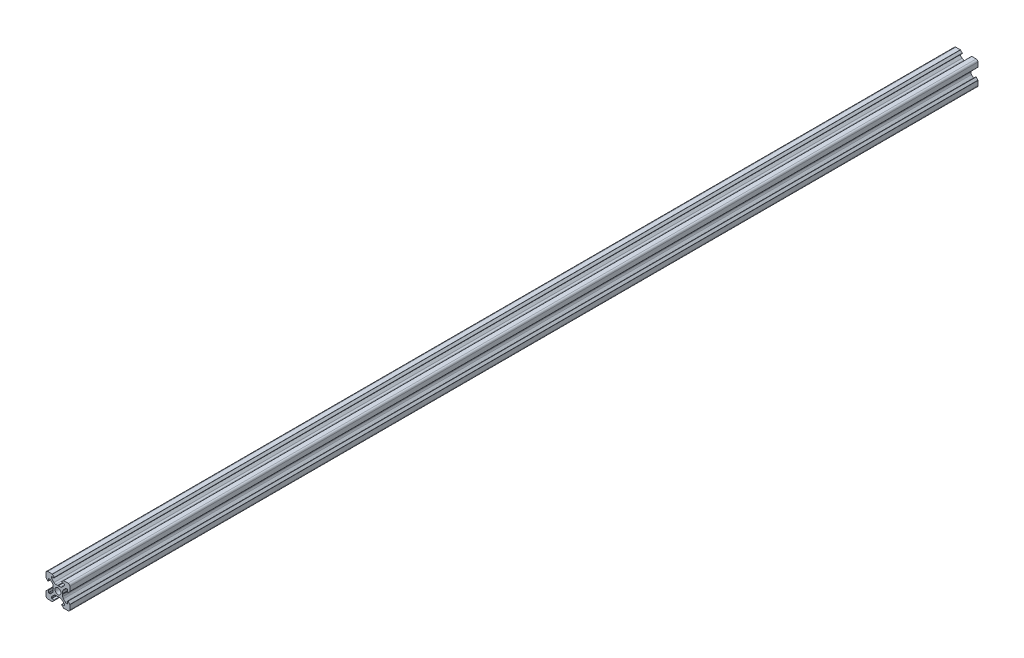
from build123d import *

# Parameters (mm, degrees)
MODEL_R         = 2.5
EXTRUDE_1_DEPTH = 760


with BuildPart() as part:
    # Model → Бобышка-Вытянуть1 (new body)
    with BuildSketch(Plane.XY):
        with BuildLine():
            Line((18.94214915, 33.362214718), (18.94214915, 34.923300122))
            ThreePointArc((18.94214915, 34.923300122), (18.789908215, 35.688666987), (18.356362712, 36.337513684))
            Line((18.356362712, 36.337513684), (16.662250163, 38.031626234))
            ThreePointArc((16.662250163, 38.031626234), (16.337826814, 38.248398985), (15.955143382, 38.324519453))
            Line((15.955143382, 38.324519453), (15.14214915, 38.324519453))
            ThreePointArc((15.14214915, 38.324519453), (15.000727794, 38.265940809), (14.94214915, 38.124519453))
            Line((14.94214915, 38.124519453), (14.94214915, 36.354519453))
            ThreePointArc((14.94214915, 36.354519453), (14.787820008, 36.12354957), (14.515372455, 36.177742757))
            Line((14.515372455, 36.177742757), (13.015372455, 37.677742757))
            ThreePointArc((13.015372455, 37.677742757), (12.961179267, 37.758848595), (12.94214915, 37.854519453))
            Line((12.94214915, 37.854519453), (12.94214915, 41.524519453))
            ThreePointArc((12.94214915, 41.524519453), (13.381488978, 42.585179625), (14.44214915, 43.024519453))
            Line((14.44214915, 43.024519453), (18.11214915, 43.024519453))
            ThreePointArc((18.11214915, 43.024519453), (18.207820008, 43.005489336), (18.288925845, 42.951296148))
            Line((18.288925845, 42.951296148), (19.788925845, 41.451296148))
            ThreePointArc((19.788925845, 41.451296148), (19.843119033, 41.178848595), (19.61214915, 41.024519453))
            Line((19.61214915, 41.024519453), (17.84214915, 41.024519453))
            ThreePointArc((17.84214915, 41.024519453), (17.700727794, 40.965940809), (17.64214915, 40.824519453))
            Line((17.64214915, 40.824519453), (17.64214915, 40.011525221))
            ThreePointArc((17.64214915, 40.011525221), (17.718269617, 39.628841789), (17.935042369, 39.30441844))
            Line((17.935042369, 39.30441844), (19.629154919, 37.61030589))
            ThreePointArc((19.629154919, 37.61030589), (20.278001616, 37.176760388), (21.043368481, 37.024519453))
            Line((21.043368481, 37.024519453), (22.604453885, 37.024519453))
            ThreePointArc((22.604453885, 37.024519453), (22.687205621, 37.010426533), (22.760627647, 36.969736655))
            Line((22.760627647, 36.969736655), (22.94214915, 36.824519453))
            Line((22.94214915, 36.824519453), (23.123670653, 36.969736655))
            ThreePointArc((23.123670653, 36.969736655), (23.197092679, 37.010426533), (23.279844415, 37.024519453))
            Line((23.279844415, 37.024519453), (24.840929819, 37.024519453))
            ThreePointArc((24.840929819, 37.024519453), (25.606296684, 37.176760388), (26.255143382, 37.61030589))
            Line((26.255143382, 37.61030589), (27.949255931, 39.30441844))
            ThreePointArc((27.949255931, 39.30441844), (28.166028683, 39.628841789), (28.24214915, 40.011525221))
            Line((28.24214915, 40.011525221), (28.24214915, 40.824519453))
            ThreePointArc((28.24214915, 40.824519453), (28.183570506, 40.965940809), (28.04214915, 41.024519453))
            Line((28.04214915, 41.024519453), (26.27214915, 41.024519453))
            ThreePointArc((26.27214915, 41.024519453), (26.041179267, 41.178848595), (26.095372455, 41.451296148))
            Line((26.095372455, 41.451296148), (27.595372455, 42.951296148))
            ThreePointArc((27.595372455, 42.951296148), (27.676478292, 43.005489336), (27.77214915, 43.024519453))
            Line((27.77214915, 43.024519453), (31.44214915, 43.024519453))
            ThreePointArc((31.44214915, 43.024519453), (32.502809322, 42.585179625), (32.94214915, 41.524519453))
            Line((32.94214915, 41.524519453), (32.94214915, 37.854519453))
            ThreePointArc((32.94214915, 37.854519453), (32.923119033, 37.758848595), (32.868925845, 37.677742757))
            Line((32.868925845, 37.677742757), (31.368925845, 36.177742757))
            ThreePointArc((31.368925845, 36.177742757), (31.096478292, 36.12354957), (30.94214915, 36.354519453))
            Line((30.94214915, 36.354519453), (30.94214915, 38.124519453))
            ThreePointArc((30.94214915, 38.124519453), (30.883570506, 38.265940809), (30.74214915, 38.324519453))
            Line((30.74214915, 38.324519453), (29.929154919, 38.324519453))
            ThreePointArc((29.929154919, 38.324519453), (29.546471486, 38.248398985), (29.222048137, 38.031626234))
            Line((29.222048137, 38.031626234), (27.527935588, 36.337513684))
            ThreePointArc((27.527935588, 36.337513684), (27.094390085, 35.688666987), (26.94214915, 34.923300122))
            Line((26.94214915, 34.923300122), (26.94214915, 33.362214718))
            ThreePointArc((26.94214915, 33.362214718), (26.92805623, 33.279462982), (26.887366352, 33.206040956))
            Line((26.887366352, 33.206040956), (26.74214915, 33.024519453))
            Line((26.74214915, 33.024519453), (26.887366352, 32.84299795))
            ThreePointArc((26.887366352, 32.84299795), (26.92805623, 32.769575923), (26.94214915, 32.686824188))
            Line((26.94214915, 32.686824188), (26.94214915, 31.125738784))
            ThreePointArc((26.94214915, 31.125738784), (27.094390085, 30.360371919), (27.527935588, 29.711525221))
            Line((27.527935588, 29.711525221), (29.222048137, 28.017412672))
            ThreePointArc((29.222048137, 28.017412672), (29.546471486, 27.80063992), (29.929154919, 27.724519453))
            Line((29.929154919, 27.724519453), (30.74214915, 27.724519453))
            ThreePointArc((30.74214915, 27.724519453), (30.883570506, 27.783098097), (30.94214915, 27.924519453))
            Line((30.94214915, 27.924519453), (30.94214915, 29.694519453))
            ThreePointArc((30.94214915, 29.694519453), (31.096478292, 29.925489336), (31.368925845, 29.871296148))
            Line((31.368925845, 29.871296148), (32.868925845, 28.371296148))
            ThreePointArc((32.868925845, 28.371296148), (32.923119033, 28.290190311), (32.94214915, 28.194519453))
            Line((32.94214915, 28.194519453), (32.94214915, 24.524519453))
            ThreePointArc((32.94214915, 24.524519453), (32.502809322, 23.463859281), (31.44214915, 23.024519453))
            Line((31.44214915, 23.024519453), (27.77214915, 23.024519453))
            ThreePointArc((27.77214915, 23.024519453), (27.676478292, 23.04354957), (27.595372455, 23.097742757))
            Line((27.595372455, 23.097742757), (26.095372455, 24.597742757))
            ThreePointArc((26.095372455, 24.597742757), (26.041179267, 24.870190311), (26.27214915, 25.024519453))
            Line((26.27214915, 25.024519453), (28.04214915, 25.024519453))
            ThreePointArc((28.04214915, 25.024519453), (28.183570506, 25.083098097), (28.24214915, 25.224519453))
            Line((28.24214915, 25.224519453), (28.24214915, 26.037513684))
            ThreePointArc((28.24214915, 26.037513684), (28.166028683, 26.420197117), (27.949255931, 26.744620465))
            Line((27.949255931, 26.744620465), (26.255143382, 28.438733015))
            ThreePointArc((26.255143382, 28.438733015), (25.606296684, 28.872278518), (24.840929819, 29.024519453))
            Line((24.840929819, 29.024519453), (23.279844415, 29.024519453))
            ThreePointArc((23.279844415, 29.024519453), (23.197092679, 29.038612373), (23.123670653, 29.07930225))
            Line((23.123670653, 29.07930225), (22.94214915, 29.224519453))
            Line((22.94214915, 29.224519453), (22.760627647, 29.07930225))
            ThreePointArc((22.760627647, 29.07930225), (22.687205621, 29.038612373), (22.604453885, 29.024519453))
            Line((22.604453885, 29.024519453), (21.043368481, 29.024519453))
            ThreePointArc((21.043368481, 29.024519453), (20.278001616, 28.872278518), (19.629154919, 28.438733015))
            Line((19.629154919, 28.438733015), (17.935042369, 26.744620465))
            ThreePointArc((17.935042369, 26.744620465), (17.718269617, 26.420197117), (17.64214915, 26.037513684))
            Line((17.64214915, 26.037513684), (17.64214915, 25.224519453))
            ThreePointArc((17.64214915, 25.224519453), (17.700727794, 25.083098097), (17.84214915, 25.024519453))
            Line((17.84214915, 25.024519453), (19.61214915, 25.024519453))
            ThreePointArc((19.61214915, 25.024519453), (19.843119033, 24.870190311), (19.788925845, 24.597742757))
            Line((19.788925845, 24.597742757), (18.288925845, 23.097742757))
            ThreePointArc((18.288925845, 23.097742757), (18.207820008, 23.04354957), (18.11214915, 23.024519453))
            Line((18.11214915, 23.024519453), (14.44214915, 23.024519453))
            ThreePointArc((14.44214915, 23.024519453), (13.381488978, 23.463859281), (12.94214915, 24.524519453))
            Line((12.94214915, 24.524519453), (12.94214915, 28.194519453))
            ThreePointArc((12.94214915, 28.194519453), (12.961179267, 28.290190311), (13.015372455, 28.371296148))
            Line((13.015372455, 28.371296148), (14.515372455, 29.871296148))
            ThreePointArc((14.515372455, 29.871296148), (14.787820008, 29.925489336), (14.94214915, 29.694519453))
            Line((14.94214915, 29.694519453), (14.94214915, 27.924519453))
            ThreePointArc((14.94214915, 27.924519453), (15.000727794, 27.783098097), (15.14214915, 27.724519453))
            Line((15.14214915, 27.724519453), (15.955143382, 27.724519453))
            ThreePointArc((15.955143382, 27.724519453), (16.337826814, 27.80063992), (16.662250163, 28.017412672))
            Line((16.662250163, 28.017412672), (18.356362712, 29.711525221))
            ThreePointArc((18.356362712, 29.711525221), (18.789908215, 30.360371919), (18.94214915, 31.125738784))
            Line((18.94214915, 31.125738784), (18.94214915, 32.686824188))
            ThreePointArc((18.94214915, 32.686824188), (18.95624207, 32.769575923), (18.996931948, 32.84299795))
            Line((18.996931948, 32.84299795), (19.14214915, 33.024519453))
            Line((19.14214915, 33.024519453), (18.996931948, 33.206040956))
            ThreePointArc((18.996931948, 33.206040956), (18.95624207, 33.279462982), (18.94214915, 33.362214718))
        make_face()
        with Locations((22.94214915, 33.024519453)):
            Circle(MODEL_R, mode=Mode.SUBTRACT)
    extrude(amount=EXTRUDE_1_DEPTH)


solid = part.part
